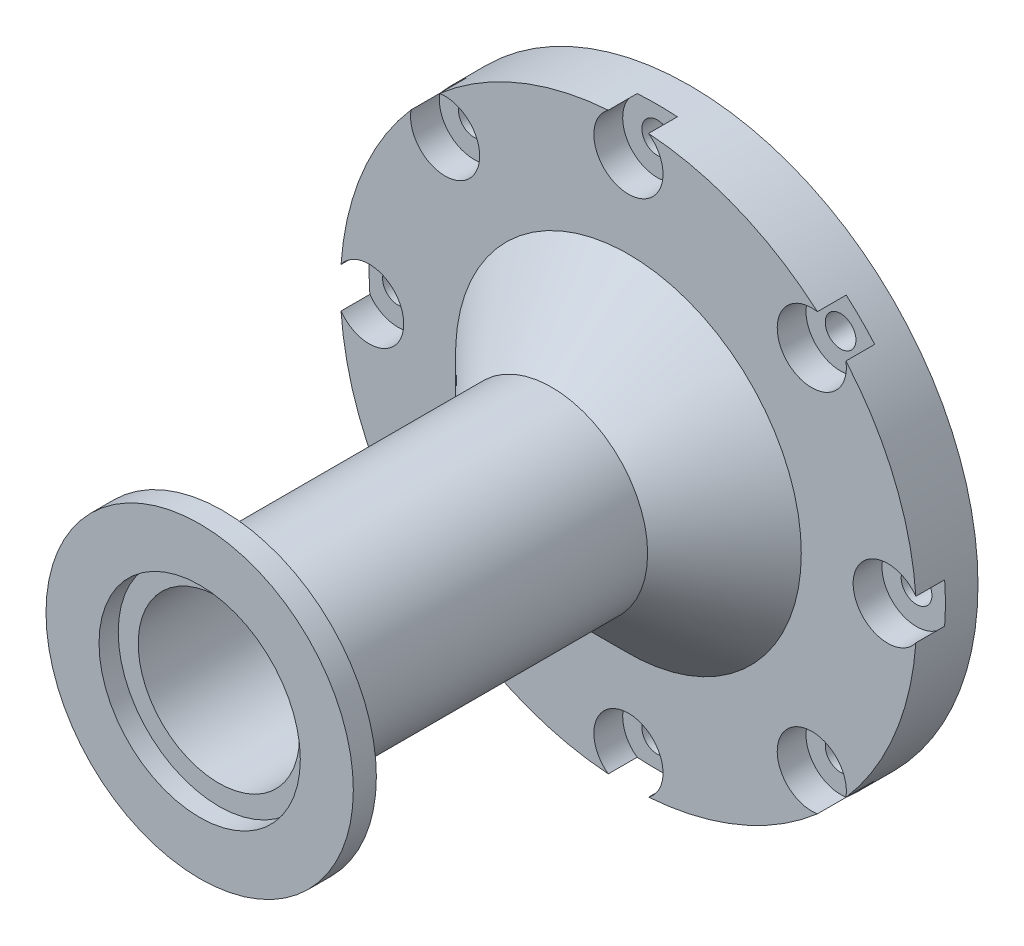
from build123d import *

# Parameters (mm, degrees)
SKETCH2_R           = 37.5
SKETCH2_R_2         = 5.35
BOSS_EXTRUDE2_DEPTH = 8
SKETCH14_R          = 2
CUT_EXTRUDE6_DEPTH  = 54.633012222
SKETCH3_R           = 20.71
SKETCH3_R_2         = 19.21
CUT_EXTRUDE2_DEPTH  = 2
SKETCH7_R           = 12.5
SKETCH7_R_2         = 10.5
BOSS_EXTRUDE4_DEPTH = 50.8
SKETCH10_R          = 12.5
BOSS_EXTRUDE5_DEPTH = 2.01
BOSS_EXTRUDE5_DRAFT = -75
SKETCH11_R          = 10.5
CUT_EXTRUDE3_DEPTH  = 81.686777727
BOSS_EXTRUDE6_START = 3
SKETCH12_R          = 20.001422123
SKETCH12_R_2        = 10.5
BOSS_EXTRUDE6_DEPTH = 3
SKETCH13_R          = 13.1
CUT_EXTRUDE4_DEPTH  = 2.5
CHAMFER1_SIZE       = 10
SKETCH17_R          = 4.5
CUT_EXTRUDE8_DEPTH  = 3.75


with BuildPart() as part:
    # Sketch2 → Boss-Extrude2 (new body)
    with BuildSketch(Plane.XY):
        Circle(SKETCH2_R)
        Circle(SKETCH2_R_2, mode=Mode.SUBTRACT)
    extrude(amount=BOSS_EXTRUDE2_DEPTH)

    # Sketch14 → Cut-Extrude6 (cut, through all)
    with BuildSketch(Plane.XY):
        with Locations((0, 33.75)):
            Circle(SKETCH14_R)
        with Locations((-23.864853865, 23.864853865)):
            Circle(SKETCH14_R)
        with Locations((-33.75, 0)):
            Circle(SKETCH14_R)
        with Locations((-23.864853865, -23.864853865)):
            Circle(SKETCH14_R)
        with Locations((0, -33.75)):
            Circle(SKETCH14_R)
        with Locations((23.864853865, -23.864853865)):
            Circle(SKETCH14_R)
        with Locations((33.75, 0)):
            Circle(SKETCH14_R)
        with Locations((23.864853865, 23.864853865)):
            Circle(SKETCH14_R)
    extrude(amount=CUT_EXTRUDE6_DEPTH, mode=Mode.SUBTRACT)

    # Sketch3 → Cut-Extrude2 (cut)
    with BuildSketch(Plane.XY):
        Circle(SKETCH3_R)
        Circle(SKETCH3_R_2, mode=Mode.SUBTRACT)
    extrude(amount=CUT_EXTRUDE2_DEPTH, mode=Mode.SUBTRACT)

    # Sketch7 → Boss-Extrude4 (add)
    with BuildSketch(Plane.XY.offset(8)):
        Circle(SKETCH7_R)
        Circle(SKETCH7_R_2, mode=Mode.SUBTRACT)
    extrude(amount=BOSS_EXTRUDE4_DEPTH)


with BuildPart() as boss_extrude5_tool:
    # Sketch10 → Boss-Extrude5 (with draft: the straight prism first)
    with BuildSketch(Plane.XY.offset(58.8)):
        Circle(SKETCH10_R)
    extrude(amount=BOSS_EXTRUDE5_DEPTH)
    # Boss-Extrude5: the draft: its side faces are tilted about the plane it starts from
    boss_extrude5_sides = [boss_extrude5_tool.faces().sort_by_distance(p)[0] for p in [
        (-12.5, 0, 59.805),
    ]]
    draft(boss_extrude5_sides, Plane.XY.offset(58.8), BOSS_EXTRUDE5_DRAFT)


with BuildPart() as part_1:
    add(part.part)

    # Boss-Extrude5: add boss_extrude5_tool
    add(boss_extrude5_tool.part)

    # Sketch11 → Cut-Extrude3 (cut, through all)
    with BuildSketch(Plane.XY.offset(60.81)):
        Circle(SKETCH11_R)
    extrude(amount=-CUT_EXTRUDE3_DEPTH, mode=Mode.SUBTRACT)

    # Sketch12 → Boss-Extrude6 (add)
    with BuildSketch(Plane.XY.offset(60.81).offset(BOSS_EXTRUDE6_START)):
        Circle(SKETCH12_R)
        Circle(SKETCH12_R_2, mode=Mode.SUBTRACT)
    extrude(amount=-BOSS_EXTRUDE6_DEPTH)

    # Sketch13 → Cut-Extrude4 (cut)
    with BuildSketch(Plane.XY.offset(63.81)):
        Circle(SKETCH13_R)
    extrude(amount=-CUT_EXTRUDE4_DEPTH, mode=Mode.SUBTRACT)

    # Chamfer1
    chamfer1_edges = [part_1.edges().sort_by_distance(p)[0] for p in [
        (-12.5, 0, 8),
    ]]
    chamfer(chamfer1_edges, length=CHAMFER1_SIZE)

    # Sketch17 → Cut-Extrude8 (cut)
    with BuildSketch(Plane.XY.offset(8)):
        with Locations((-23.864853865, 23.864853865)):
            Circle(SKETCH17_R)
        with Locations((-33.75, 0)):
            Circle(SKETCH17_R)
        with Locations((0, 33.75)):
            Circle(SKETCH17_R)
        with Locations((23.864853865, 23.864853865)):
            Circle(SKETCH17_R)
        with Locations((33.75, 0)):
            Circle(SKETCH17_R)
        with Locations((23.864853865, -23.864853865)):
            Circle(SKETCH17_R)
        with Locations((0, -33.75)):
            Circle(SKETCH17_R)
        with Locations((-23.864853865, -23.864853865)):
            Circle(SKETCH17_R)
    extrude(amount=-CUT_EXTRUDE8_DEPTH, mode=Mode.SUBTRACT)


solid = part_1.part
